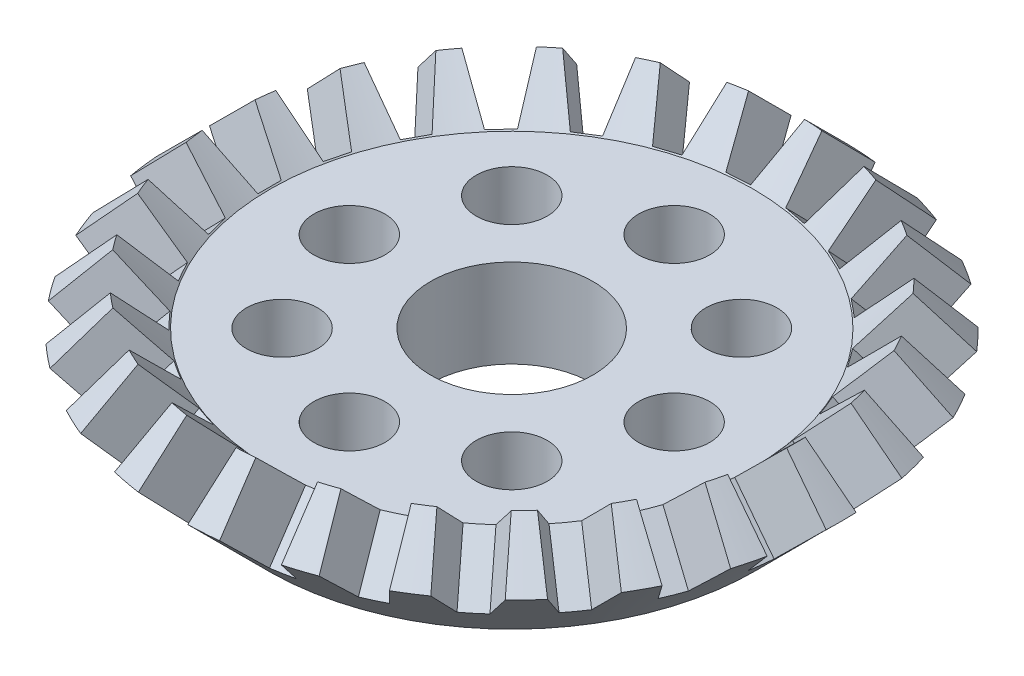
from build123d import *

# Parameters (mm, degrees)
CUT_EXTRUDE11_DEPTH = 10
CUT_EXTRUDE12_DEPTH = 10
SKETCH5_3_R         = 1.75
CUT_EXTRUDE13_DEPTH = 10
CIRPATTERN13_COUNT  = 8
CIRPATTERN14_COUNT  = 25


with BuildPart() as part:
    # Sketch2 → Revolve4 (revolve)
    with BuildSketch(Plane.XY):
        Polygon((0, 0), (0, 4.355813863), (-11.886826824, 4.355813863), (-14.008147168, 6.477134207), (-16.242640687, 4.242640687), (-12, 0), align=None)
    revolve(axis=Axis((0, 0, 0), (0, 1, 0)))

    # Sketch4 → Cut-Extrude11 (cut)
    with BuildSketch(Plane(origin=(-6, -6, 0), x_dir=(0, 0, 1), z_dir=(-0.7071067811865476, -0.7071067811865475, 0))):
        Polygon((-0.575906499, 11.556444953), (0.575906499, 11.556444953), (1.411909827, 14.888208465), (-1.411909827, 14.888208465), align=None)
    cut_extrude11 = extrude(amount=-CUT_EXTRUDE11_DEPTH, mode=Mode.SUBTRACT)

    # Sketch5 → Cut-Extrude12 (cut)
    with BuildSketch(Plane(origin=(0, 4.355813863, 0), x_dir=(1, 0, 0), z_dir=(0, 1, 0))):
        with BuildLine():
            ThreePointArc((4, 0), (-2.828427125, 2.828427125), (0, -4))
            ThreePointArc((0, -4), (2.828427125, -2.828427125), (4, 0))
        make_face()
    extrude(amount=-CUT_EXTRUDE12_DEPTH, mode=Mode.SUBTRACT)

    # Sketch5<3> → Cut-Extrude13 (cut)
    with BuildSketch(Plane(origin=(0, 4.355813863, 0), x_dir=(1, 0, 0), z_dir=(0, 1, 0))):
        with Locations((0, -8)):
            Circle(SKETCH5_3_R)
    cut_extrude13 = extrude(amount=-CUT_EXTRUDE13_DEPTH, mode=Mode.SUBTRACT)

    # CirPattern13: Cut-Extrude13 ×8 about axis
    cirpattern13_axis = Axis((0, 20.485281374, 0), (0, -1, 0))
    for i in range(1, CIRPATTERN13_COUNT):
        add(cut_extrude13.rotate(cirpattern13_axis, i * 360 / CIRPATTERN13_COUNT), mode=Mode.SUBTRACT)

    # CirPattern14: Cut-Extrude11 ×25 about axis
    cirpattern14_axis = Axis((0, 0, 0), (0, 1, 0))
    for i in range(1, CIRPATTERN14_COUNT):
        add(cut_extrude11.rotate(cirpattern14_axis, i * 360 / CIRPATTERN14_COUNT), mode=Mode.SUBTRACT)


solid = part.part
